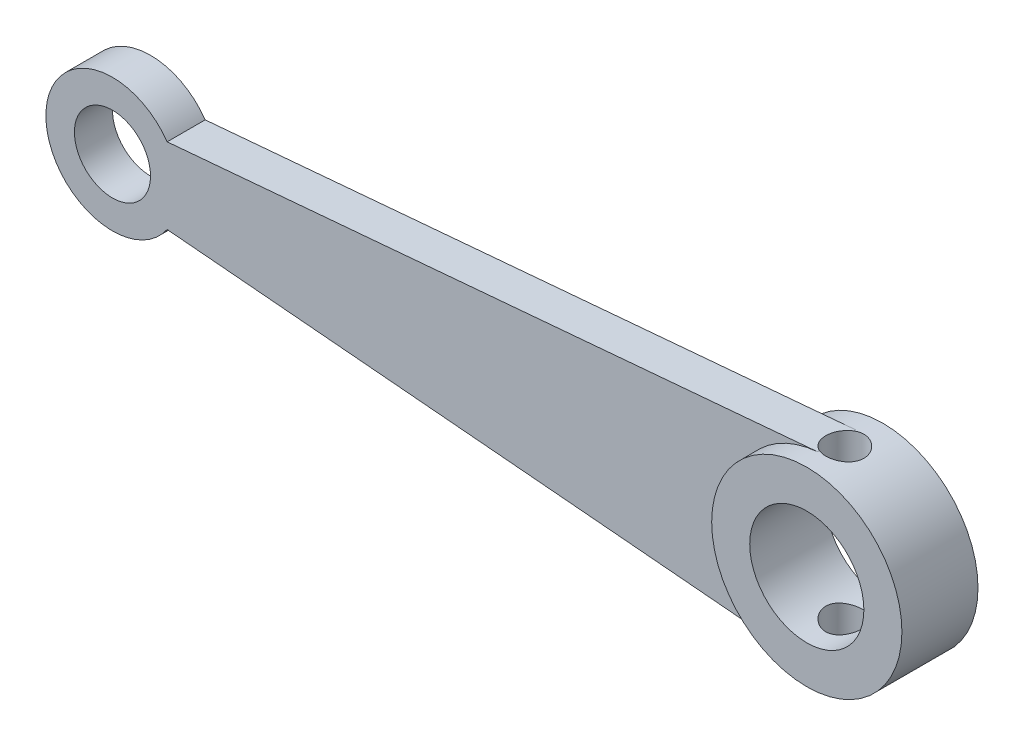
from build123d import *
from build123d.topology import SkipClean

# Parameters (mm, degrees)
SKETCH1_R           = 5
SKETCH1_R_2         = 3
SKETCH1_R_3         = 2
BOSS_EXTRUDE1_DEPTH = 1
SKETCH2_R           = 5
BOSS_EXTRUDE2_DEPTH = 1
SKETCH3_R           = 5
BOSS_EXTRUDE3_DEPTH = 1
SKETCH4_R           = 1
CUT_EXTRUDE1_DEPTH  = 25
SKETCH5_R           = 3
CUT_EXTRUDE2_DEPTH  = 10


with BuildPart() as part:
    # Sketch1 → Boss-Extrude1 (new, symmetric)
    # profile 1 of 2: a face of its own
    with BuildSketch(Plane.XY):
        Circle(SKETCH1_R)
        Circle(SKETCH1_R_2, mode=Mode.SUBTRACT)
    # profile 2 of 2: a face of its own
    with BuildSketch(Plane.XY):
        with BuildLine():
            ThreePointArc((-34.624678, 1.995626), (-41, 0), (-34.624678, -1.995626))
            Line((-34.624678, -1.995626), (-0.434941, -4.981047))
            ThreePointArc((-0.434941, -4.981047), (-5, 0), (-0.434941, 4.981047))
            Line((-0.434941, 4.981047), (-34.624678, 1.995626))
        make_face()
        with Locations((-37.5, 0)):
            Circle(SKETCH1_R_3, mode=Mode.SUBTRACT)
    extrude(amount=BOSS_EXTRUDE1_DEPTH, both=True)

    # Sketch2 → Boss-Extrude2 (add, symmetric)
    with BuildSketch(Plane.XY.offset(1)):
        with Locations(Location((0, 0, 0), (0, 0, 265.009636))):
            Circle(SKETCH2_R)
    extrude(amount=BOSS_EXTRUDE2_DEPTH, both=True)

    # Sketch3 → Boss-Extrude3 (add, symmetric)
    with BuildSketch(Plane(origin=(0, 0, -1), x_dir=(-1, 0, 0), z_dir=(0, 0, -1))):
        Circle(SKETCH3_R)
    extrude(amount=BOSS_EXTRUDE3_DEPTH, both=True)

    # Sketch4 → Cut-Extrude1 (cut, symmetric)
    with SkipClean():  # the faces are left unmerged after this step: merging them gives an invalid solid
        with BuildSketch(Plane(origin=(0, 0, 0), x_dir=(1, 0, 0), z_dir=(0, 1, 0))):
            with Locations(Location((0, 0, 0), (0, 0, 244.218462))):
                Circle(SKETCH4_R)
        extrude(amount=CUT_EXTRUDE1_DEPTH, both=True, mode=Mode.SUBTRACT)

    # Sketch5 → Cut-Extrude2 (cut)
    with SkipClean():  # the faces are left unmerged after this step: merging them gives an invalid solid
        with BuildSketch(Plane(origin=(0, 0, -2), x_dir=(-1, 0, 0), z_dir=(0, 0, -1))):
            Circle(SKETCH5_R)
        extrude(amount=-CUT_EXTRUDE2_DEPTH, mode=Mode.SUBTRACT)


solid = part.part
